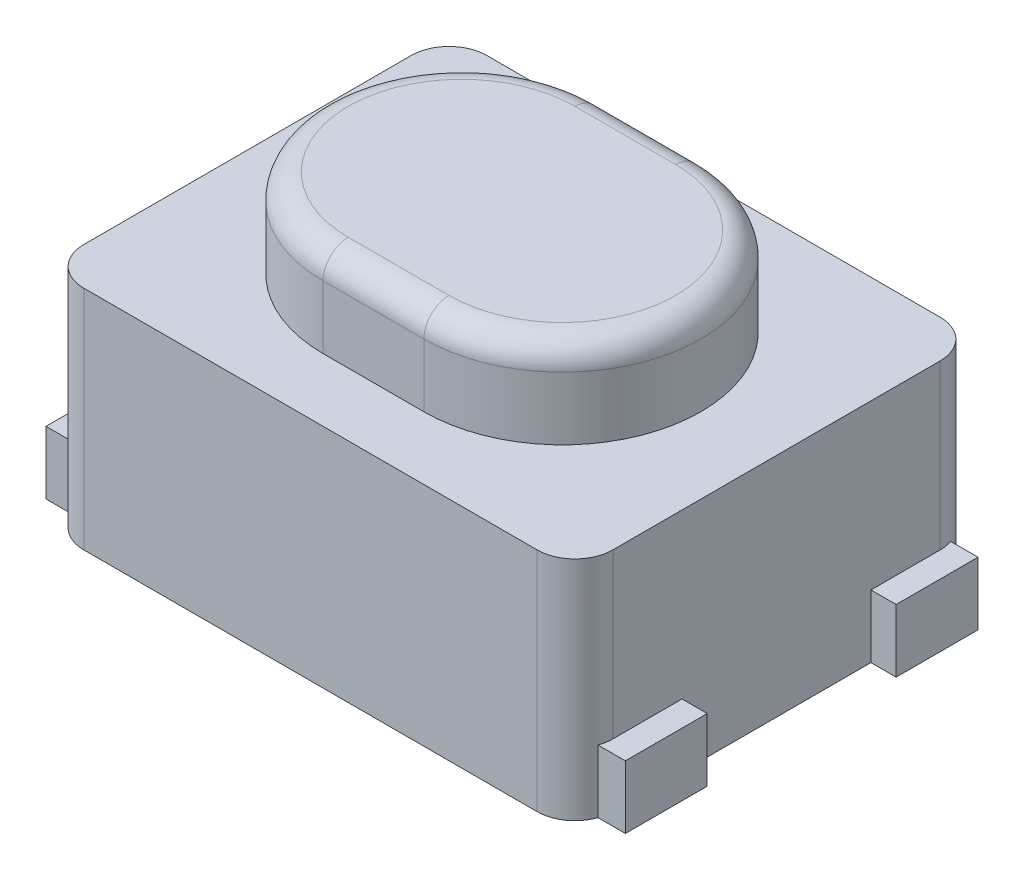
from build123d import *

# Parameters (mm, degrees)
BOSS_EXTRUDE1_DEPTH = 1.8
BOSS_EXTRUDE2_DEPTH = 2.5
FILLET1_R           = 0.2
SKETCH3_W           = 0.75
SKETCH3_H           = 0.65
BOSS_EXTRUDE3_DEPTH = 0.5


with BuildPart() as part:
    # Sketch1 → Boss-Extrude1 (new body)
    with BuildSketch(Plane(origin=(0, 0, 0), x_dir=(1, 0, 0), z_dir=(0, 1, 0))):
        with BuildLine():
            Line((-1.8, 1.6), (1.8, 1.6))
            ThreePointArc((1.8, 1.6), (2.012132034, 1.512132034), (2.1, 1.3))
            Line((2.1, 1.3), (2.1, -1.3))
            ThreePointArc((2.1, -1.3), (2.012132034, -1.512132034), (1.8, -1.6))
            Line((1.8, -1.6), (-1.8, -1.6))
            ThreePointArc((-1.8, -1.6), (-2.012132034, -1.512132034), (-2.1, -1.3))
            Line((-2.1, -1.3), (-2.1, 1.3))
            ThreePointArc((-2.1, 1.3), (-2.012132034, 1.512132034), (-1.8, 1.6))
        make_face()
    extrude(amount=BOSS_EXTRUDE1_DEPTH)

    # Sketch2 → Boss-Extrude2 (add)
    with BuildSketch(Plane(origin=(0, 0, 0), x_dir=(1, 0, 0), z_dir=(0, 1, 0))):
        with BuildLine():
            Line((-0.4, 1.1), (0.4, 1.1))
            ThreePointArc((0.4, 1.1), (1.5, 0), (0.4, -1.1))
            Line((0.4, -1.1), (-0.4, -1.1))
            ThreePointArc((-0.4, -1.1), (-1.5, 0), (-0.4, 1.1))
        make_face()
    extrude(amount=BOSS_EXTRUDE2_DEPTH)

    # Fillet1
    fillet1_edges = [part.edges().sort_by_distance(p)[0] for p in [
        (-1.5, 2.5, 0),
        (0, 2.5, 1.1),
        (1.5, 2.5, 0),
        (0, 2.5, -1.1),
    ]]
    fillet(fillet1_edges, radius=FILLET1_R)

    # Sketch3 → Boss-Extrude3 (add)
    with BuildSketch(Plane(origin=(0, 0, 0), x_dir=(1, 0, 0), z_dir=(0, 1, 0))):
        with Locations((1.925, 1.075)):
            Rectangle(SKETCH3_W, SKETCH3_H)
        with Locations((1.925, -1.075)):
            Rectangle(SKETCH3_W, SKETCH3_H)
    boss_extrude3 = extrude(amount=BOSS_EXTRUDE3_DEPTH)

    # Mirror1: Boss-Extrude3 across plane
    add(boss_extrude3.mirror(Plane(origin=(0, 0, 0), x_dir=(0, 0, 1), z_dir=(1, 0, 0))))


solid = part.part
